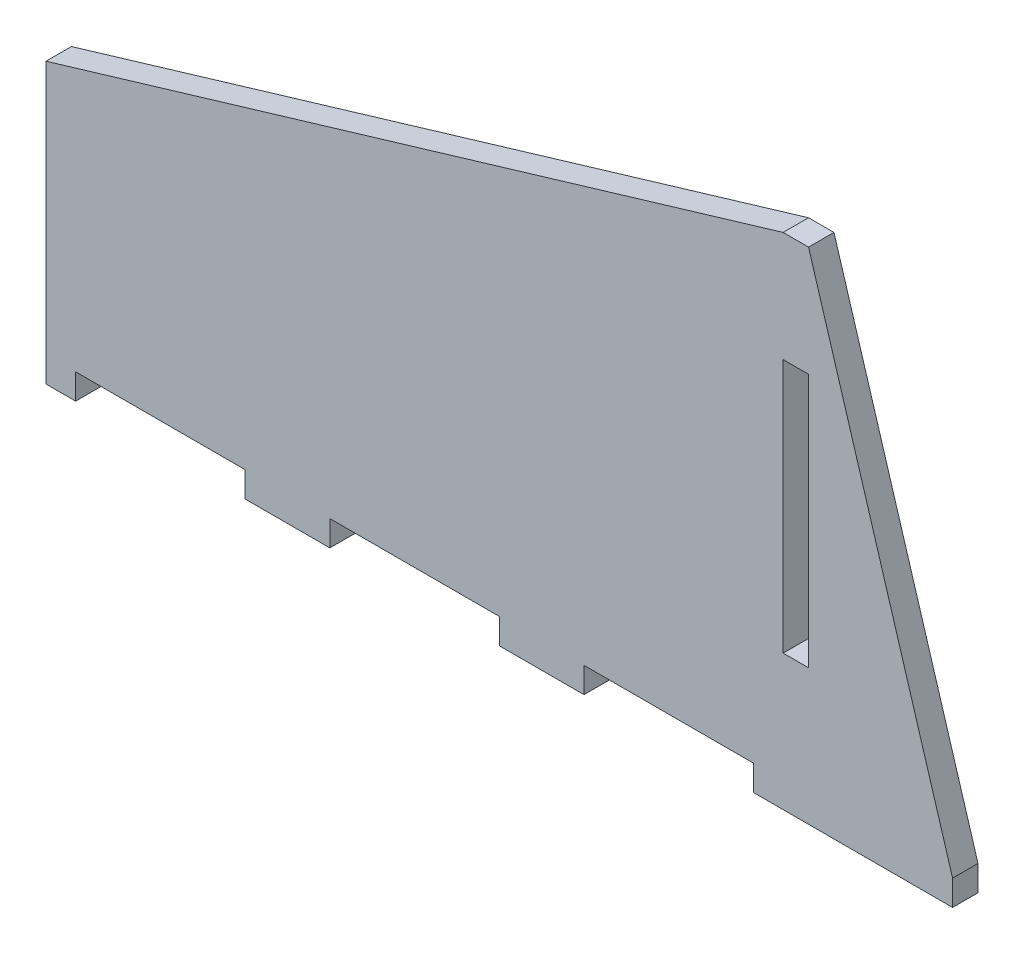
from build123d import *

# Parameters (mm, degrees)
SKETCH1_W           = 3
SKETCH1_H           = 30
BOSS_EXTRUDE1_DEPTH = 3


with BuildPart() as part:
    # Sketch1 → Boss-Extrude1 (new body)
    with BuildSketch(Plane.XY):
        Polygon((-90, 0), (-86.5, 0), (-86.5, 3), (-66.5, 3), (-66.5, 0), (-56.5, 0), (-56.5, 3), (-36.5, 3), (-36.5, 0), (-26.5, 0), (-26.5, 3), (-6.5, 3), (-6.5, 0), (17, 0), (17, 3), (0, 59), (-3, 59), (-90, 33), align=None)
        with Locations((-1.5, 31)):
            Rectangle(SKETCH1_W, SKETCH1_H, mode=Mode.SUBTRACT)
    extrude(amount=BOSS_EXTRUDE1_DEPTH)


solid = part.part
